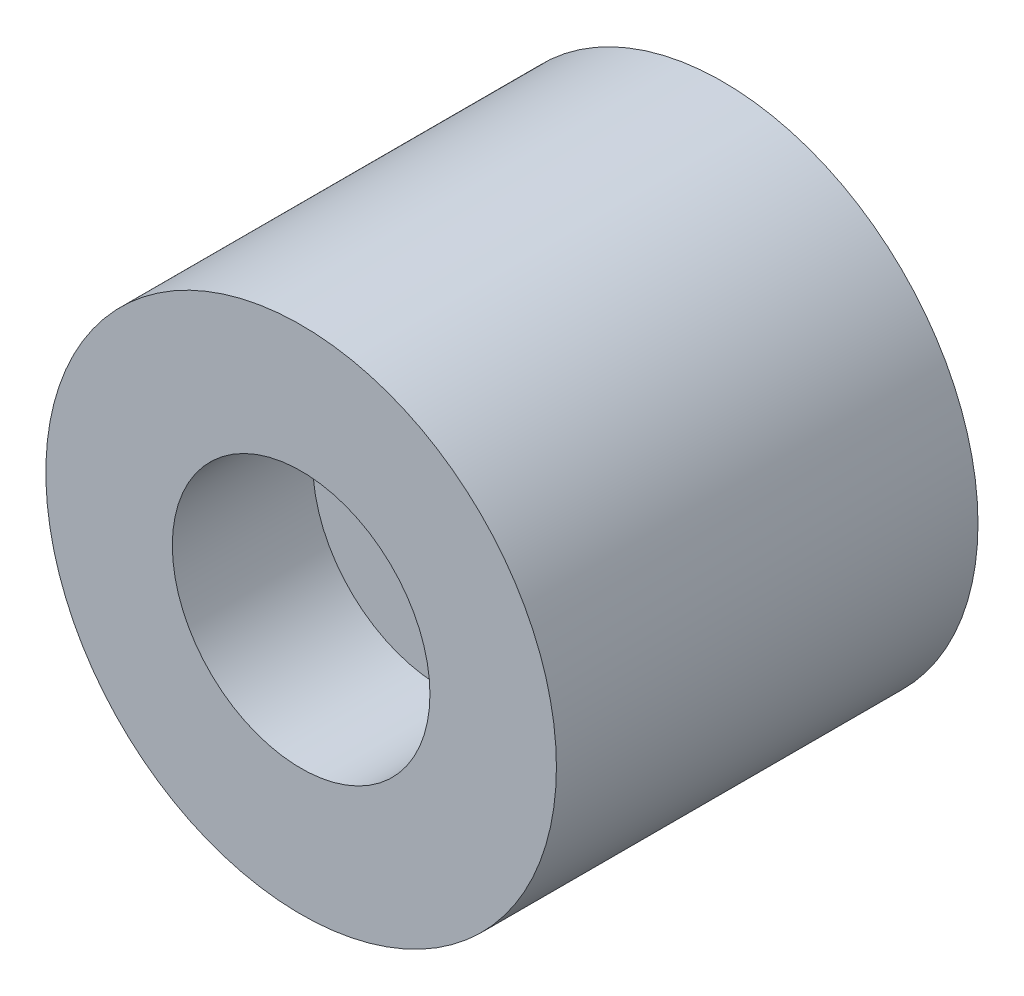
from build123d import *

# Parameters (mm, degrees)
SKETCH1_R           = 5.45
BOSS_EXTRUDE1_DEPTH = 9
SKETCH2_R           = 2.75
CUT_EXTRUDE1_DEPTH  = 3


with BuildPart() as part:
    # Sketch1 → Boss-Extrude1 (new body)
    with BuildSketch(Plane.XY):
        Circle(SKETCH1_R)
    extrude(amount=BOSS_EXTRUDE1_DEPTH)

    # Sketch2 → Cut-Extrude1 (cut)
    with BuildSketch(Plane.XY.offset(9)):
        Circle(SKETCH2_R)
    extrude(amount=-CUT_EXTRUDE1_DEPTH, mode=Mode.SUBTRACT)


solid = part.part
